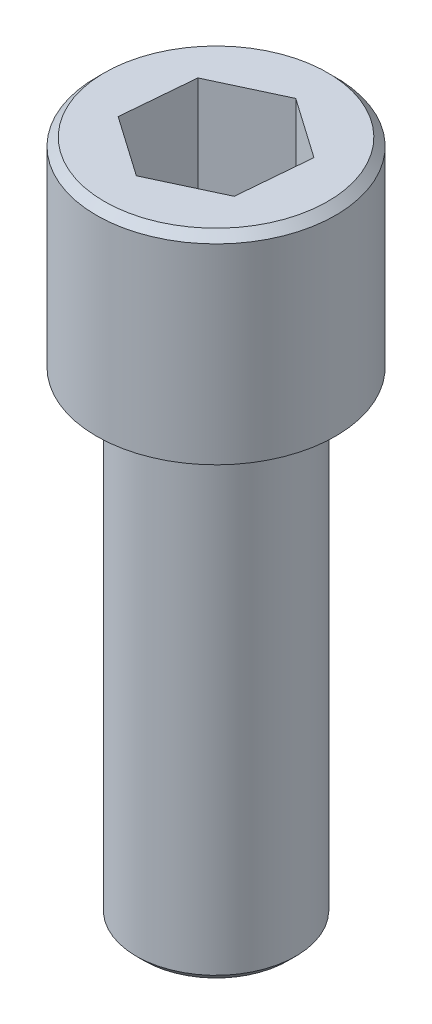
from build123d import *

# Parameters (mm, degrees)
SKICA1_R                 = 2.5
P_IDAT_VYSUNUT_M1_DEPTH  = 15
SKICA2_R                 = 3.75
P_IDAT_VYSUNUT_M2_DEPTH  = 6.25
ODEBRAT_VYSUNUT_M1_DEPTH = 3.75
ZKOSEN_1_SIZE            = 0.25


with BuildPart() as part:
    # Skica1 → Přidat vysunutím1 (new body)
    with BuildSketch(Plane(origin=(0, 0, 0), x_dir=(1, 0, 0), z_dir=(0, 1, 0))):
        with Locations(Location((0, 0, 0), (0, 0, 270))):
            Circle(SKICA1_R)
    extrude(amount=P_IDAT_VYSUNUT_M1_DEPTH)

    # Skica2 → Přidat vysunutím2 (add)
    with BuildSketch(Plane(origin=(0, 15, 0), x_dir=(1, 0, 0), z_dir=(0, 1, 0))):
        with Locations(Location((0, 0, 0), (0, 0, 270))):
            Circle(SKICA2_R)
    extrude(amount=P_IDAT_VYSUNUT_M2_DEPTH)

    # Skica3 → Odebrat vysunutím1 (cut)
    with BuildSketch(Plane(origin=(0, 21.25, 0), x_dir=(1, 0, 0), z_dir=(0, 1, 0))):
        Polygon((-0.199101745, -2.300802431), (1.893002482, -1.322828385), (2.092104227, 0.977974047), (0.199101745, 2.300802431), (-1.893002482, 1.322828385), (-2.092104227, -0.977974047), align=None)
    extrude(amount=-ODEBRAT_VYSUNUT_M1_DEPTH, mode=Mode.SUBTRACT)

    # Zkosení1
    zkosen_1_edges = [part.edges().sort_by_distance(p)[0] for p in [
        (0, 0, -2.5),
        (0, 21.25, -3.75),
    ]]
    chamfer(zkosen_1_edges, length=ZKOSEN_1_SIZE)


solid = part.part
